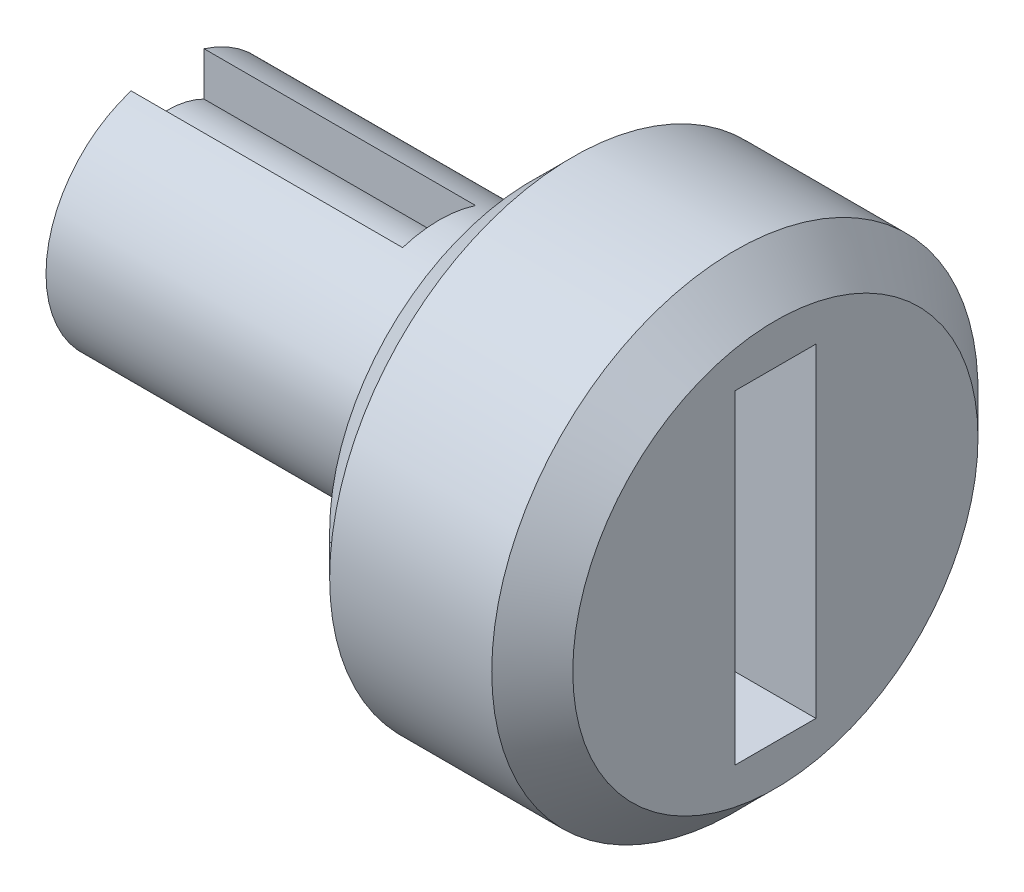
from build123d import *

# Parameters (mm, degrees)
SKETCH3_R          = 1
CUT_EXTRUDE1_DEPTH = 9
SKETCH4_W          = 2
SKETCH4_H          = 8
CUT_EXTRUDE2_DEPTH = 4
CHAMFER1_SIZE      = 1
CUT_EXTRUDE3_START = -6.7
CUT_EXTRUDE3_DEPTH = 6.7


with BuildPart() as part:
    # Sketch2 → Revolve1 (revolve)
    with BuildSketch(Plane(origin=(0, 0, 0), x_dir=(1, 0, 0), z_dir=(0, 1, 0)), mode=Mode.PRIVATE) as revolve1_sk:
        Polygon((0, 0), (0, 3), (9, 3), (9, 6), (15, 6), (15, 0), align=None)
    revolve(revolve1_sk.sketch.rotate(Axis((0, 0, 0), (1, 0, 0)), 180), axis=Axis((0, 0, 0), (1, 0, 0)))

    # Sketch3 → Cut-Extrude1 (cut)
    with BuildSketch(Plane.ZY):
        Circle(SKETCH3_R)
    extrude(amount=-CUT_EXTRUDE1_DEPTH, mode=Mode.SUBTRACT)

    # Sketch4 → Cut-Extrude2 (cut)
    with BuildSketch(Plane(origin=(15, 0, 0), x_dir=(0, 0, -1), z_dir=(1, 0, 0))):
        Rectangle(SKETCH4_W, SKETCH4_H)
    extrude(amount=-CUT_EXTRUDE2_DEPTH, mode=Mode.SUBTRACT)

    # Chamfer1
    chamfer1_edges = [part.edges().sort_by_distance(p)[0] for p in [
        (15, 0, -6),
        (9, 0, -6),
    ]]
    chamfer(chamfer1_edges, length=CHAMFER1_SIZE)

    # Sketch5 → Cut-Extrude3 (cut)
    with BuildSketch(Plane.ZY.offset(CUT_EXTRUDE3_START)):
        with BuildLine():
            Line((-0.9, 2.861817604), (-0.9, 1.78605711))
            ThreePointArc((-0.9, 1.78605711), (0, 2), (0.9, 1.78605711))
            Line((0.9, 1.78605711), (0.9, 2.861817604))
            ThreePointArc((0.9, 2.861817604), (0, 3), (-0.9, 2.861817604))
        make_face()
        with BuildLine():
            Line((-0.9, -1.78605711), (-0.9, -2.861817604))
            ThreePointArc((-0.9, -2.861817604), (0, -3), (0.9, -2.861817604))
            Line((0.9, -2.861817604), (0.9, -1.78605711))
            ThreePointArc((0.9, -1.78605711), (0, -2), (-0.9, -1.78605711))
        make_face()
    extrude(amount=CUT_EXTRUDE3_DEPTH, mode=Mode.SUBTRACT)


solid = part.part
